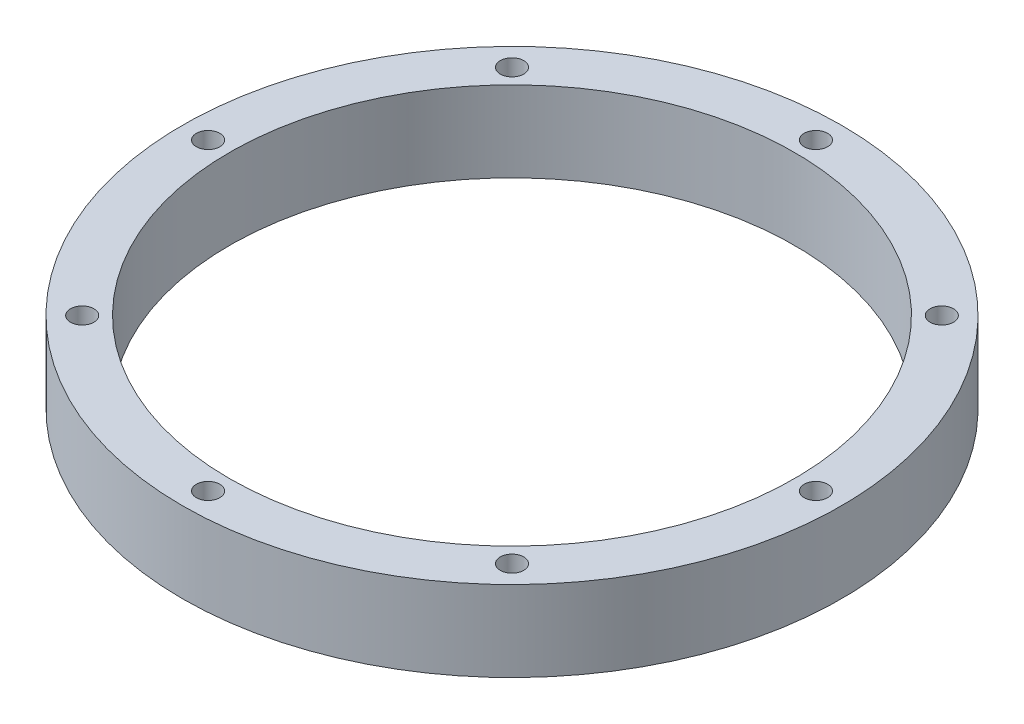
from build123d import *

# Parameters (mm, degrees)
SKETCH1_R           = 45
SKETCH1_R_2         = 38.575
SKETCH1_R_3         = 1.6
BOSS_EXTRUDE1_DEPTH = 11


with BuildPart() as part:
    # Sketch1 → Boss-Extrude1 (new body)
    with BuildSketch(Plane(origin=(0, 0, 0), x_dir=(1, 0, 0), z_dir=(0, 1, 0))):
        with Locations(Location((0, 0, 0), (0, 0, 270))):
            Circle(SKETCH1_R)
        with Locations(Location((0, 0, 0), (0, 0, 270))):
            Circle(SKETCH1_R_2, mode=Mode.SUBTRACT)
        with Locations(Location((0, 41.5, 0), (0, 0, 270))):
            Circle(SKETCH1_R_3, mode=Mode.SUBTRACT)
        with Locations(Location((29.344931419, 29.344931419, 0), (0, 0, 270))):
            Circle(SKETCH1_R_3, mode=Mode.SUBTRACT)
        with Locations(Location((41.5, 0, 0), (0, 0, 270))):
            Circle(SKETCH1_R_3, mode=Mode.SUBTRACT)
        with Locations(Location((29.344931419, -29.344931419, 0), (0, 0, 270))):
            Circle(SKETCH1_R_3, mode=Mode.SUBTRACT)
        with Locations(Location((0, -41.5, 0), (0, 0, 270))):
            Circle(SKETCH1_R_3, mode=Mode.SUBTRACT)
        with Locations(Location((-29.344931419, -29.344931419, 0), (0, 0, 270))):
            Circle(SKETCH1_R_3, mode=Mode.SUBTRACT)
        with Locations(Location((-41.5, 0, 0), (0, 0, 270))):
            Circle(SKETCH1_R_3, mode=Mode.SUBTRACT)
        with Locations(Location((-29.344931419, 29.344931419, 0), (0, 0, 270))):
            Circle(SKETCH1_R_3, mode=Mode.SUBTRACT)
    extrude(amount=BOSS_EXTRUDE1_DEPTH)


solid = part.part
